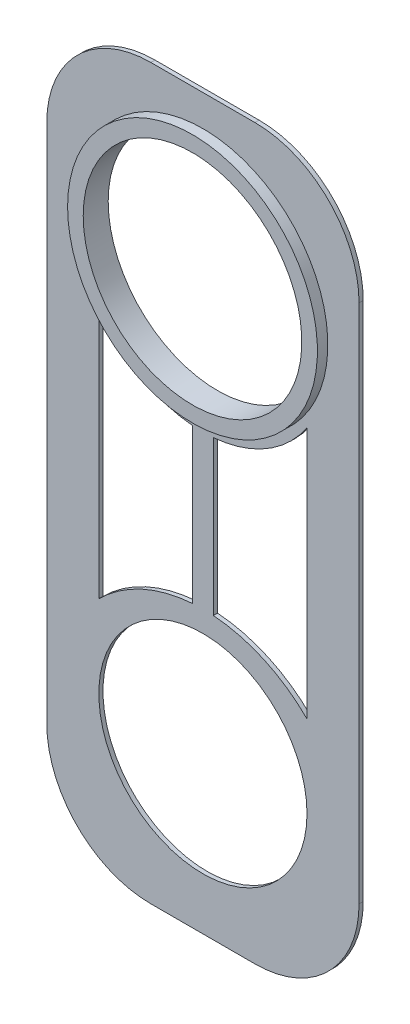
from build123d import *
from build123d.topology import SkipClean

# Parameters (mm, degrees)
SKETCH2_R           = 13.335
SKETCH2_R_2         = 12.7
BOSS_EXTRUDE1_DEPTH = 0.508
BOSS_EXTRUDE2_START = 1.27
SKETCH3_R           = 15.24
SKETCH3_R_2         = 13.335
BOSS_EXTRUDE2_DEPTH = 1.27
CUT_EXTRUDE1_DEPTH  = 97.736659463
BOSS_EXTRUDE3_DEPTH = 0.508


with BuildPart() as part:
    # Sketch2 → Boss-Extrude1 (new body)
    with BuildSketch(Plane.XY):
        with BuildLine():
            Line((12.7, 0), (25.4, 0))
            ThreePointArc((25.4, 0), (34.380256121, 3.719743879), (38.1, 12.7))
            Line((38.1, 12.7), (38.1, 76.2))
            ThreePointArc((38.1, 76.2), (34.380256121, 85.180256121), (25.4, 88.9))
            Line((25.4, 88.9), (12.7, 88.9))
            ThreePointArc((12.7, 88.9), (3.719743879, 85.180256121), (0, 76.2))
            Line((0, 76.2), (0, 12.7))
            ThreePointArc((0, 12.7), (3.719743879, 3.719743879), (12.7, 0))
        make_face()
        with Locations((19.05, 69.85)):
            Circle(SKETCH2_R, mode=Mode.SUBTRACT)
        with Locations((19.05, 19.05)):
            Circle(SKETCH2_R_2, mode=Mode.SUBTRACT)
    extrude(amount=BOSS_EXTRUDE1_DEPTH)

    # Sketch3 → Boss-Extrude2 (add)
    with SkipClean():  # the faces are left unmerged after this step: merging them gives an invalid solid
        with BuildSketch(Plane(origin=(0, 0, 0), x_dir=(-1, 0, 0), z_dir=(0, 0, -1)).offset(BOSS_EXTRUDE2_START)):
            with Locations((-19.05, 69.85)):
                Circle(SKETCH3_R)
            with Locations((-19.05, 69.85)):
                Circle(SKETCH3_R_2, mode=Mode.SUBTRACT)
        boss_extrude2 = extrude(amount=-BOSS_EXTRUDE2_DEPTH)

    # Mirror1: Boss-Extrude2 across plane
    add(boss_extrude2.mirror(Plane(origin=(0, 0, 0.254), x_dir=(1, 0, 0), z_dir=(0, 0, -1))))

    # Sketch4 → Cut-Extrude1 (cut, through all)
    with BuildSketch(Plane(origin=(0, 0, 0), x_dir=(-1, 0, 0), z_dir=(0, 0, -1))):
        with BuildLine():
            Line((-31.75, 29.058935454), (-31.75, 59.841064546))
            ThreePointArc((-31.75, 59.841064546), (-19.05, 53.025291513), (-6.35, 59.841064546))
            Line((-6.35, 59.841064546), (-6.35, 29.058935454))
            ThreePointArc((-6.35, 29.058935454), (-19.05, 34.319447696), (-31.75, 29.058935454))
        make_face()
    extrude(amount=-CUT_EXTRUDE1_DEPTH, mode=Mode.SUBTRACT)

    # Sketch5 → Boss-Extrude3 (add)
    with BuildSketch(Plane(origin=(0, 0, 0), x_dir=(-1, 0, 0), z_dir=(0, 0, -1))):
        Polygon((-20.32, 53.025291513), (-20.32, 34.319447696), (-20.32, 34.162691866), (-17.78, 34.162691866), (-17.78, 34.23115412), (-17.78, 34.319447696), (-17.78, 53.025291513), (-17.78, 53.171866838), (-20.32, 53.171866838), align=None)
    extrude(amount=-BOSS_EXTRUDE3_DEPTH)


solid = part.part
